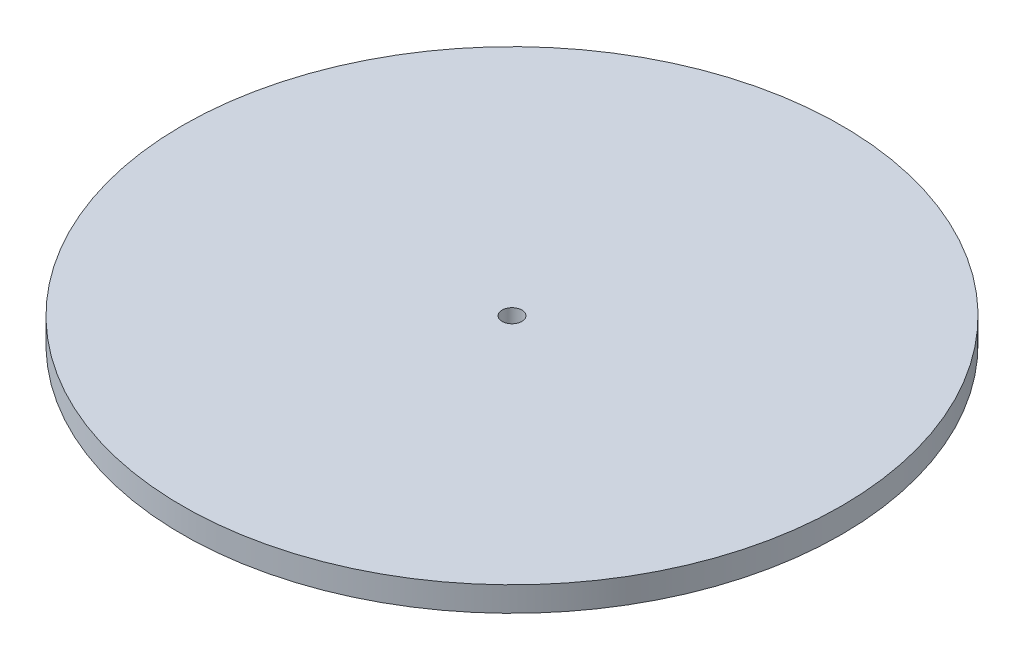
from build123d import *

# Parameters (mm, degrees)
SKETCH5_R          = 1.2
CUT_EXTRUDE1_DEPTH = 58.928459079


with BuildPart() as part:
    # Sketch3 → Revolve4 (revolve)
    with BuildSketch(Plane.XY, mode=Mode.PRIVATE) as revolve4_sk:
        with BuildLine():
            Line((1.2, 12.478235804), (1.2, 7.478235804))
            Line((1.2, 7.478235804), (0, 7.478235804))
            Line((0, 7.478235804), (0, 0))
            add(Edge.make_bspline(
                [(0, 0), (4.625000001, 0.001117069), (9.250000001, 0.607415338), (13.875000001, 1.887337305), (18.500000001, 3.109072854), (23.125000001, 4.490616829), (27.750000001, 5.825831958), (32.375, 7.16643161), (37, 8.478235804)],
                knots=[0.083402717, 0.083402717, 0.083402717, 0.083402717, 0.083402717, 0.083402717, 0.083402717, 0.083402717, 0.083402717, 0.917429887, 0.917429887, 0.917429887, 0.917429887, 0.917429887, 0.917429887, 0.917429887, 0.917429887, 0.917429887], degree=8))
            Line((37, 8.478235804), (37, 9.478235804))
            Line((37, 9.478235804), (40, 9.478235804))
            Line((40, 9.478235804), (40, 12.478235804))
            Line((40, 12.478235804), (1.2, 12.478235804))
        make_face()
    revolve(revolve4_sk.sketch.rotate(Axis((0, 12.478235804, 0), (0, -1, 0)), 180), axis=Axis((0, 12.478235804, 0), (0, -1, 0)))

    # Sketch5 → Cut-Extrude1 (cut, through all)
    with BuildSketch(Plane(origin=(0, 12.478235804, 0), x_dir=(1, 0, 0), z_dir=(0, 1, 0))):
        with Locations(Location((0, 0, 0), (0, 0, 180))):
            Circle(SKETCH5_R)
    extrude(amount=-CUT_EXTRUDE1_DEPTH, mode=Mode.SUBTRACT)


solid = part.part
